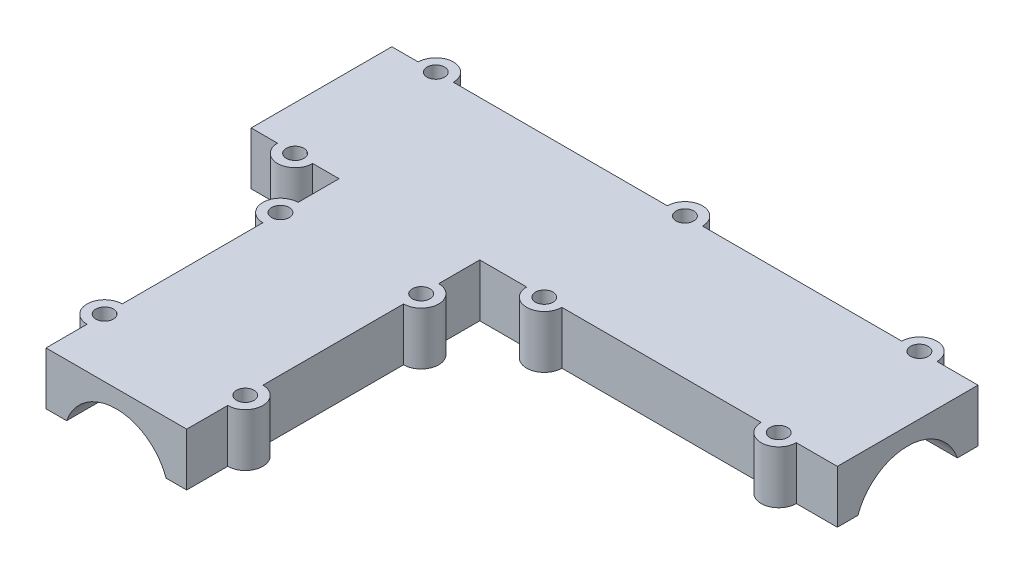
from build123d import *

# Parameters (mm, degrees)
SKETCH1_W               = 24
SKETCH1_H               = 24
BOSS_EXTRUDE1_DEPTH     = 100
SKETCH2_R               = 9
CUT_EXTRUDE1_DEPTH      = 100
SKETCH3_W               = 24
SKETCH3_H               = 24
BOSS_EXTRUDE2_DEPTH     = 50
SKETCH4_R               = 9
CUT_EXTRUDE2_DEPTH      = 50
SKETCH5_R               = 3
BOSS_EXTRUDE3_DEPTH     = 24
SKETCH6_R               = 1.5
CUT_EXTRUDE3_DEPTH      = 24
CUT_EXTRUDE4_DEPTH      = 115.350338871
CUT_EXTRUDE4_DEPTH_BACK = 115.350338871
SKETCH7_W               = 77
SKETCH7_H               = 15


with BuildPart() as part:
    # Sketch1 → Boss-Extrude1 (new body)
    with BuildSketch(Plane(origin=(0, 0, 0), x_dir=(0, 0, -1), z_dir=(1, 0, 0))):
        with Locations((12, 12)):
            Rectangle(SKETCH1_W, SKETCH1_H)
    extrude(amount=BOSS_EXTRUDE1_DEPTH)

    # Sketch2 → Cut-Extrude1 (cut)
    with BuildSketch(Plane(origin=(100, 0, 0), x_dir=(0, 0, -1), z_dir=(1, 0, 0))):
        with Locations((12, 12)):
            Circle(SKETCH2_R)
    extrude(amount=-CUT_EXTRUDE1_DEPTH, mode=Mode.SUBTRACT)

    # Sketch3 → Boss-Extrude2 (add)
    with BuildSketch(Plane.XY):
        with Locations((27, 12)):
            Rectangle(SKETCH3_W, SKETCH3_H)
    extrude(amount=BOSS_EXTRUDE2_DEPTH)

    # Sketch4 → Cut-Extrude2 (cut)
    with BuildSketch(Plane.XY.offset(50)):
        with Locations((27, 12)):
            Circle(SKETCH4_R)
    extrude(amount=-CUT_EXTRUDE2_DEPTH, mode=Mode.SUBTRACT)

    # Sketch5 → Boss-Extrude3 (add)
    with BuildSketch(Plane(origin=(0, 24, 0), x_dir=(1, 0, 0), z_dir=(0, 1, 0))):
        with Locations((90, 0)):
            Circle(SKETCH5_R)
        with Locations((90, 24)):
            Circle(SKETCH5_R)
        with Locations((50, 0)):
            Circle(SKETCH5_R)
        with Locations((50, 24)):
            Circle(SKETCH5_R)
        with Locations((7.5, 0)):
            Circle(SKETCH5_R)
        with Locations((7.5, 24)):
            Circle(SKETCH5_R)
        with Locations((15, -10)):
            Circle(SKETCH5_R)
        with Locations((39, -10)):
            Circle(SKETCH5_R)
        with Locations((15, -40)):
            Circle(SKETCH5_R)
        with Locations((39, -40)):
            Circle(SKETCH5_R)
    extrude(amount=-BOSS_EXTRUDE3_DEPTH)

    # Sketch6 → Cut-Extrude3 (cut)
    with BuildSketch(Plane(origin=(0, 24, 0), x_dir=(1, 0, 0), z_dir=(0, 1, 0))):
        with Locations(Location((50, 24, 0), (0, 0, 270))):
            Circle(SKETCH6_R)
        with Locations(Location((50, 0, 0), (0, 0, 270))):
            Circle(SKETCH6_R)
        with Locations(Location((90, 24, 0), (0, 0, 270))):
            Circle(SKETCH6_R)
        with Locations(Location((90, 0, 0), (0, 0, 270))):
            Circle(SKETCH6_R)
        with Locations(Location((15, -40, 0), (0, 0, 270))):
            Circle(SKETCH6_R)
        with Locations(Location((15, -10, 0), (0, 0, 270))):
            Circle(SKETCH6_R)
        with Locations(Location((39, -10, 0), (0, 0, 270))):
            Circle(SKETCH6_R)
        with Locations(Location((39, -40, 0), (0, 0, 270))):
            Circle(SKETCH6_R)
        with Locations(Location((7.5, 0, 0), (0, 0, 270))):
            Circle(SKETCH6_R)
        with Locations(Location((7.5, 24, 0), (0, 0, 270))):
            Circle(SKETCH6_R)
    extrude(amount=-CUT_EXTRUDE3_DEPTH, mode=Mode.SUBTRACT)

    # Sketch7 → Cut-Extrude4 (cut, two sides: drawn at the far end of the back side and taken through both)
    with BuildSketch(Plane(origin=(100, 0, 0), x_dir=(0, 0, -1), z_dir=(1, 0, 0)).offset(-CUT_EXTRUDE4_DEPTH_BACK)):
        with Locations((-11.5, 7.5)):
            Rectangle(SKETCH7_W, SKETCH7_H)
    extrude(amount=CUT_EXTRUDE4_DEPTH + CUT_EXTRUDE4_DEPTH_BACK, mode=Mode.SUBTRACT)


solid = part.part
